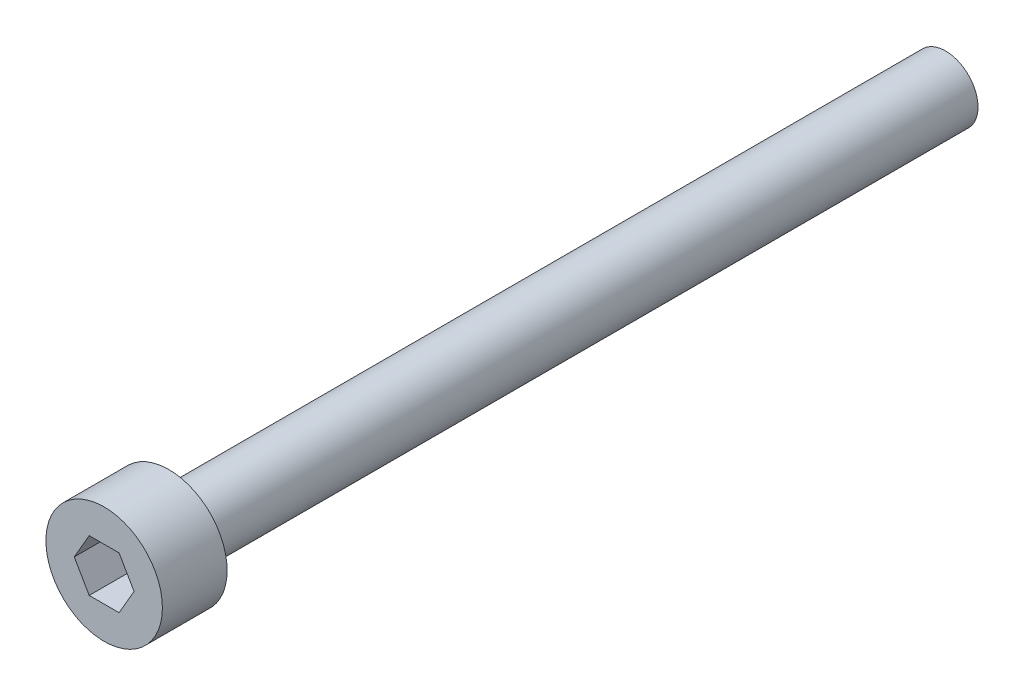
from build123d import *

# Parameters (mm, degrees)
ESQUISSE1_R             = 1.25
BOSS_EXTRU_1_DEPTH      = 30
ESQUISSE2_R             = 2.25
BOSS_EXTRU_2_DEPTH      = 2.5
ENL_V_MAT_EXTRU_1_DEPTH = 1.5


with BuildPart() as part:
    # Esquisse1 → Boss.-Extru.1 (new body)
    with BuildSketch(Plane.XY):
        Circle(ESQUISSE1_R)
    extrude(amount=BOSS_EXTRU_1_DEPTH)

    # Esquisse2 → Boss.-Extru.2 (add)
    with BuildSketch(Plane.XY.offset(30)):
        Circle(ESQUISSE2_R)
    extrude(amount=BOSS_EXTRU_2_DEPTH)

    # Esquisse3 → Enlèv. mat.-Extru.1 (cut)
    with BuildSketch(Plane.XY.offset(32.5)):
        Polygon((1.154700538, 0), (0.577350269, 1), (-0.577350269, 1), (-1.154700538, 0), (-0.577350269, -1), (0.577350269, -1), align=None)
    extrude(amount=-ENL_V_MAT_EXTRU_1_DEPTH, mode=Mode.SUBTRACT)


solid = part.part
